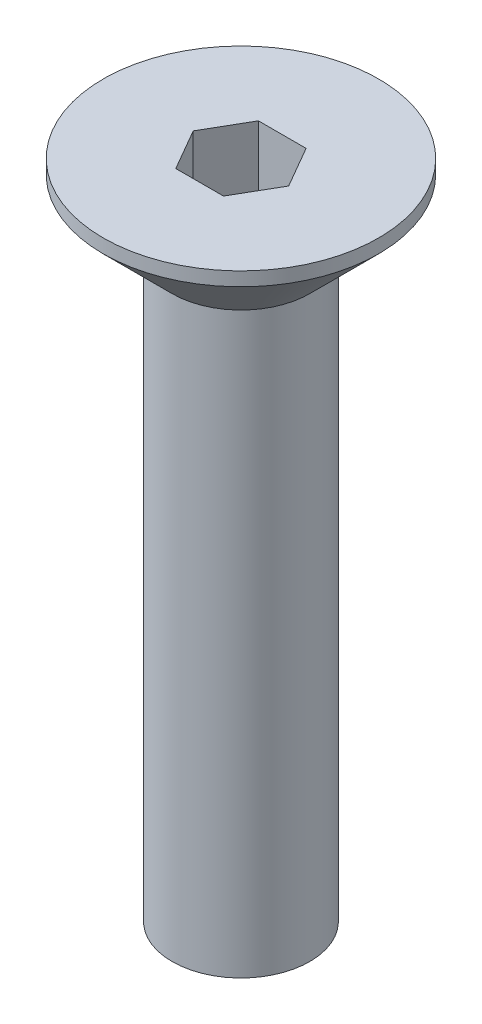
from build123d import *

# Parameters (mm, degrees)
CUT_EXTRUDE1_DEPTH = 1.5


with BuildPart() as part:
    # Sketch1 → Revolve1 (revolve)
    with BuildSketch(Plane.XY, mode=Mode.PRIVATE) as revolve1_sk:
        Polygon((0, -12), (1.25, -12), (1.25, -1.5), (2.5, -0.25), (2.5, 0), (0, 0), align=None)
    revolve(revolve1_sk.sketch.rotate(Axis((0, 61.691642626, 0), (0, -1, 0)), 90), axis=Axis((0, 61.691642626, 0), (0, -1, 0)))

    # Sketch2 → Cut-Extrude1 (cut)
    with BuildSketch(Plane(origin=(0, 0, 0), x_dir=(-1, 0, 0), z_dir=(0, 1, 0))):
        Polygon((-0.433012702, -0.75), (0.433012702, -0.75), (0.866025404, 0), (0.433012702, 0.75), (-0.433012702, 0.75), (-0.866025404, 0), align=None)
    extrude(amount=-CUT_EXTRUDE1_DEPTH, mode=Mode.SUBTRACT)


solid = part.part
